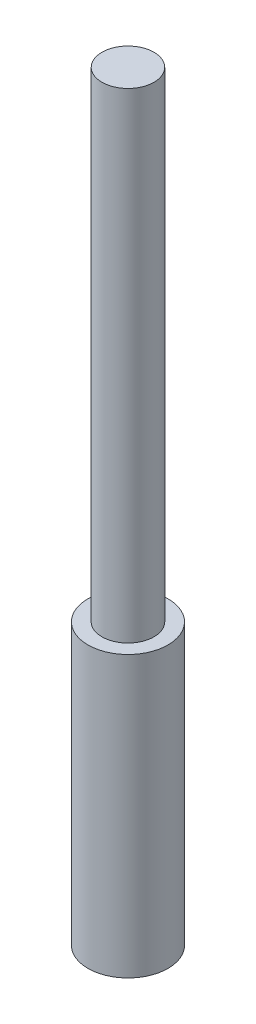
from build123d import *

# Parameters (mm, degrees)
SKETCH1_R           = 5
BOSS_EXTRUDE1_DEPTH = 95
CUT_EXTRUDE1_START  = -60
SKETCH2_R           = 5
SKETCH2_R_2         = 3.25
CUT_EXTRUDE1_DEPTH  = 60


with BuildPart() as part:
    # Sketch1 → Boss-Extrude1 (new body)
    with BuildSketch(Plane(origin=(0, 0, 0), x_dir=(1, 0, 0), z_dir=(0, 1, 0))):
        with Locations(Location((0, 0, 0), (0, 0, 270))):
            Circle(SKETCH1_R)
    extrude(amount=BOSS_EXTRUDE1_DEPTH)

    # Sketch2 → Cut-Extrude1 (cut)
    with BuildSketch(Plane(origin=(0, 95, 0), x_dir=(1, 0, 0), z_dir=(0, 1, 0)).offset(CUT_EXTRUDE1_START)):
        with Locations(Location((0, 0, 0), (0, 0, 270))):
            Circle(SKETCH2_R)
        with Locations(Location((0, 0, 0), (0, 0, 270))):
            Circle(SKETCH2_R_2, mode=Mode.SUBTRACT)
    extrude(amount=CUT_EXTRUDE1_DEPTH, mode=Mode.SUBTRACT)


solid = part.part
